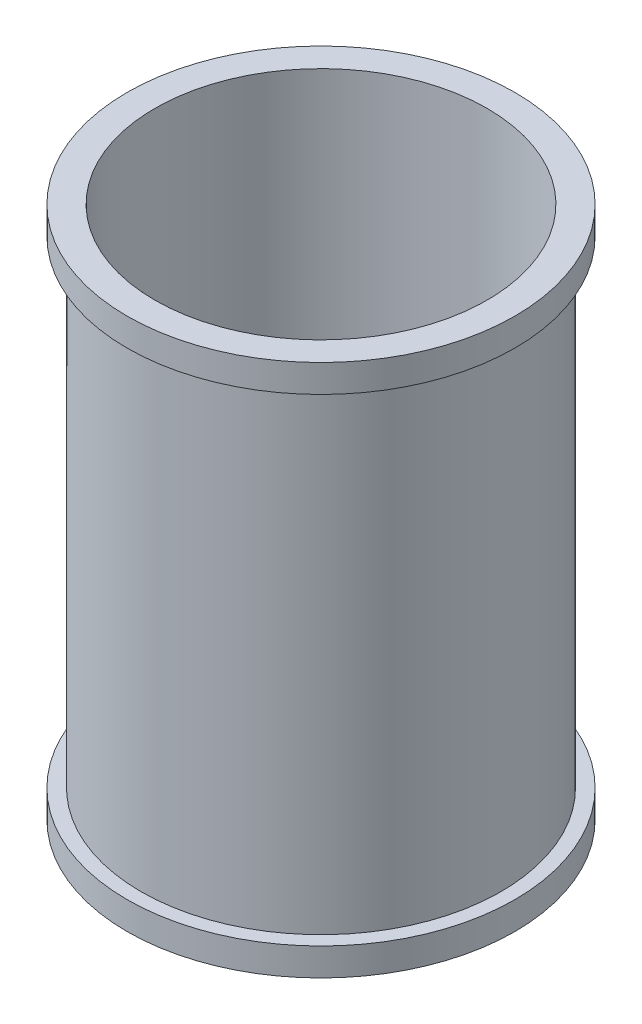
from build123d import *

# Parameters (mm, degrees)
SKETCH1_R           = 88.9
SKETCH1_R_2         = 76.2
BOSS_EXTRUDE1_DEPTH = 12.7
SKETCH2_R           = 82.55
SKETCH2_R_2         = 76.2
BOSS_EXTRUDE2_DEPTH = 219.075
SKETCH3_R           = 88.9
SKETCH3_R_2         = 76.2
BOSS_EXTRUDE3_DEPTH = 12.7


with BuildPart() as part:
    # Sketch1 → Boss-Extrude1 (new body)
    with BuildSketch(Plane(origin=(0, 0, 0), x_dir=(1, 0, 0), z_dir=(0, 1, 0))):
        with Locations(Location((0, 0, 0), (0, 0, 270))):
            Circle(SKETCH1_R)
        with Locations(Location((0, 0, 0), (0, 0, 270))):
            Circle(SKETCH1_R_2, mode=Mode.SUBTRACT)
    extrude(amount=BOSS_EXTRUDE1_DEPTH)

    # Sketch2 → Boss-Extrude2 (add)
    with BuildSketch(Plane(origin=(0, 12.7, 0), x_dir=(1, 0, 0), z_dir=(0, 1, 0))):
        with Locations(Location((0, 0, 0), (0, 0, 270))):
            Circle(SKETCH2_R)
        with Locations(Location((0, 0, 0), (0, 0, 270))):
            Circle(SKETCH2_R_2, mode=Mode.SUBTRACT)
    extrude(amount=BOSS_EXTRUDE2_DEPTH)

    # Sketch3 → Boss-Extrude3 (add)
    with BuildSketch(Plane(origin=(0, 231.775, 0), x_dir=(1, 0, 0), z_dir=(0, 1, 0))):
        with Locations(Location((0, 0, 0), (0, 0, 270))):
            Circle(SKETCH3_R)
        with Locations(Location((0, 0, 0), (0, 0, 270))):
            Circle(SKETCH3_R_2, mode=Mode.SUBTRACT)
    extrude(amount=BOSS_EXTRUDE3_DEPTH)


solid = part.part
